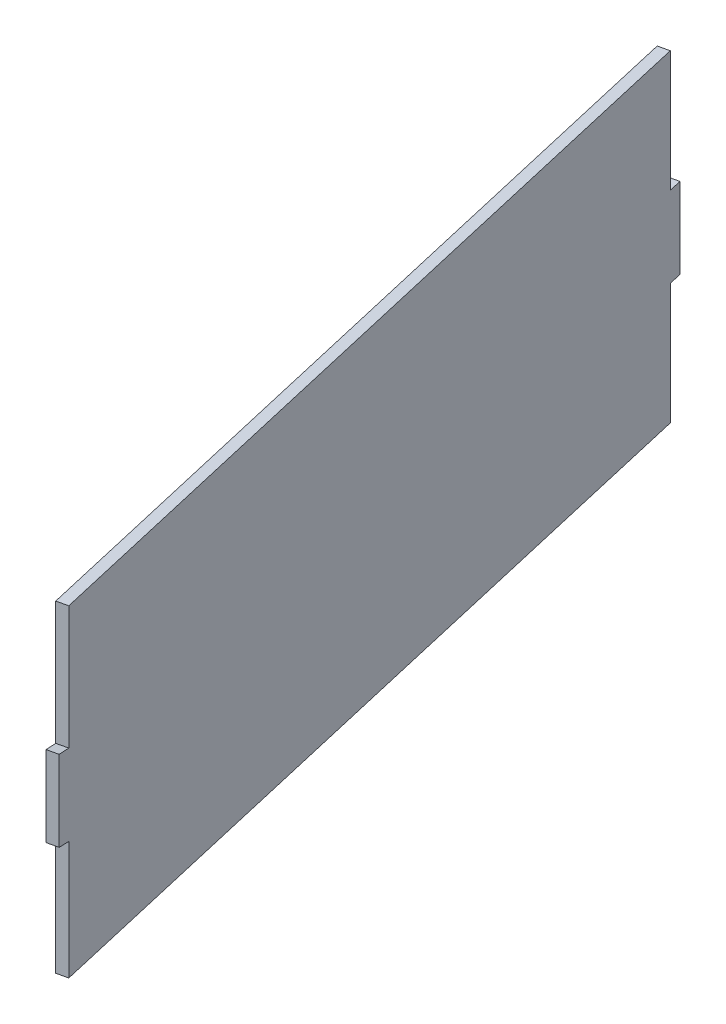
from build123d import *

# Parameters (mm, degrees)
BOSS_EXTRUDE1_DEPTH = 10.16


with BuildPart() as part:
    # Sketch1 → Boss-Extrude1 (new body)
    with BuildSketch(Plane(origin=(847.601002374, 0, -195.20861117), x_dir=(-0.22443200334393476, 0, -0.9744897515495112), z_dir=(0.9744897515495112, 0, -0.22443200334393476))):
        Polygon((2652.825504214, -41.581628832), (1906.498212352, -41.581628832), (1906.498212352, -156.254177234), (1894.498212352, -154.081628832), (1894.498212352, -229.081628832), (1906.498212352, -231.512401326), (1906.498212352, -341.581628832), (2652.825504214, -341.581628832), (2652.825504214, -229.081628832), (2664.825504214, -229.081628832), (2664.825504214, -154.081628832), (2652.825504214, -154.081628832), align=None)
    extrude(amount=-BOSS_EXTRUDE1_DEPTH)


solid = part.part
